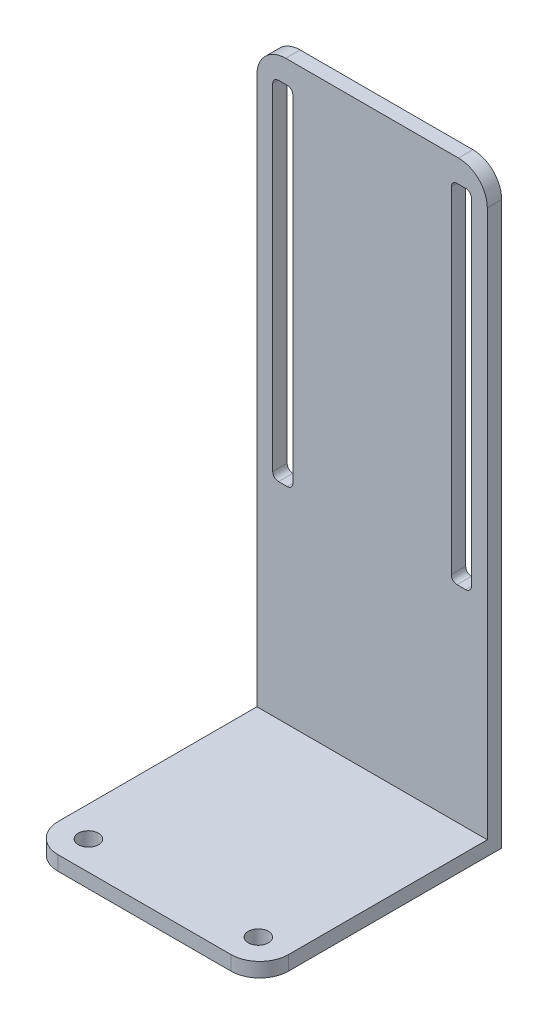
from build123d import *

# Parameters (mm, degrees)
SKETCH1_R           = 1.75
BOSS_EXTRUDE1_DEPTH = 2.5
SKETCH2_W           = 40
SKETCH2_H           = 2.5
BOSS_EXTRUDE2_DEPTH = 100
FILLET1_R           = 5
CUT_EXTRUDE1_DEPTH  = 112.653481809


with BuildPart() as part:
    # Sketch1 → Boss-Extrude1 (new body)
    with BuildSketch(Plane(origin=(0, 0, 0), x_dir=(1, 0, 0), z_dir=(0, 1, 0))):
        with BuildLine():
            Line((20, 21), (-20, 21))
            Line((-20, 21), (-20, -16))
            ThreePointArc((-20, -16), (-18.535533906, -19.535533906), (-15, -21))
            Line((-15, -21), (15, -21))
            ThreePointArc((15, -21), (18.535533906, -19.535533906), (20, -16))
            Line((20, -16), (20, 21))
        make_face()
        with Locations(Location((14.75, -16, 0), (0, 0, 270))):
            Circle(SKETCH1_R, mode=Mode.SUBTRACT)
        with Locations(Location((-14.75, -16, 0), (0, 0, 90))):
            Circle(SKETCH1_R, mode=Mode.SUBTRACT)
    extrude(amount=BOSS_EXTRUDE1_DEPTH)

    # Sketch2 → Boss-Extrude2 (add)
    with BuildSketch(Plane(origin=(0, 2.5, 0), x_dir=(1, 0, 0), z_dir=(0, 1, 0))):
        with Locations((0, 19.75)):
            Rectangle(SKETCH2_W, SKETCH2_H)
    extrude(amount=BOSS_EXTRUDE2_DEPTH)

    # Fillet1
    fillet1_edges = [part.edges().sort_by_distance(p)[0] for p in [
        (-20, 102.5, -19.75),
        (20, 102.5, -19.75),
    ]]
    fillet(fillet1_edges, radius=FILLET1_R)

    # Sketch3 → Cut-Extrude1 (cut, through all)
    with BuildSketch(Plane.XY.offset(-18.5)):
        with BuildLine():
            Line((17.25, 92.632945603), (17.25, 39.235172541))
            ThreePointArc((17.25, 39.235172541), (16.957106781, 38.52806576), (16.25, 38.235172541))
            Line((16.25, 38.235172541), (14.75, 38.235172541))
            ThreePointArc((14.75, 38.235172541), (14.042893219, 38.52806576), (13.75, 39.235172541))
            Line((13.75, 39.235172541), (13.75, 97.556357651))
            ThreePointArc((13.75, 97.556357651), (14.042893219, 98.263464432), (14.75, 98.556357651))
            Line((14.75, 98.556357651), (16.25, 98.556357651))
            ThreePointArc((16.25, 98.556357651), (16.957106781, 98.263464432), (17.25, 97.556357651))
            Line((17.25, 97.556357651), (17.25, 92.632945603))
        make_face()
        with BuildLine():
            Line((-14.75, 38.235172541), (-16.25, 38.235172541))
            ThreePointArc((-16.25, 38.235172541), (-16.957106781, 38.52806576), (-17.25, 39.235172541))
            Line((-17.25, 39.235172541), (-17.25, 92.632945603))
            Line((-17.25, 92.632945603), (-17.25, 97.556357651))
            ThreePointArc((-17.25, 97.556357651), (-16.957106781, 98.263464432), (-16.25, 98.556357651))
            Line((-16.25, 98.556357651), (-14.75, 98.556357651))
            ThreePointArc((-14.75, 98.556357651), (-14.042893219, 98.263464432), (-13.75, 97.556357651))
            Line((-13.75, 97.556357651), (-13.75, 39.235172541))
            ThreePointArc((-13.75, 39.235172541), (-14.042893219, 38.52806576), (-14.75, 38.235172541))
        make_face()
    extrude(amount=-CUT_EXTRUDE1_DEPTH, mode=Mode.SUBTRACT)


solid = part.part
